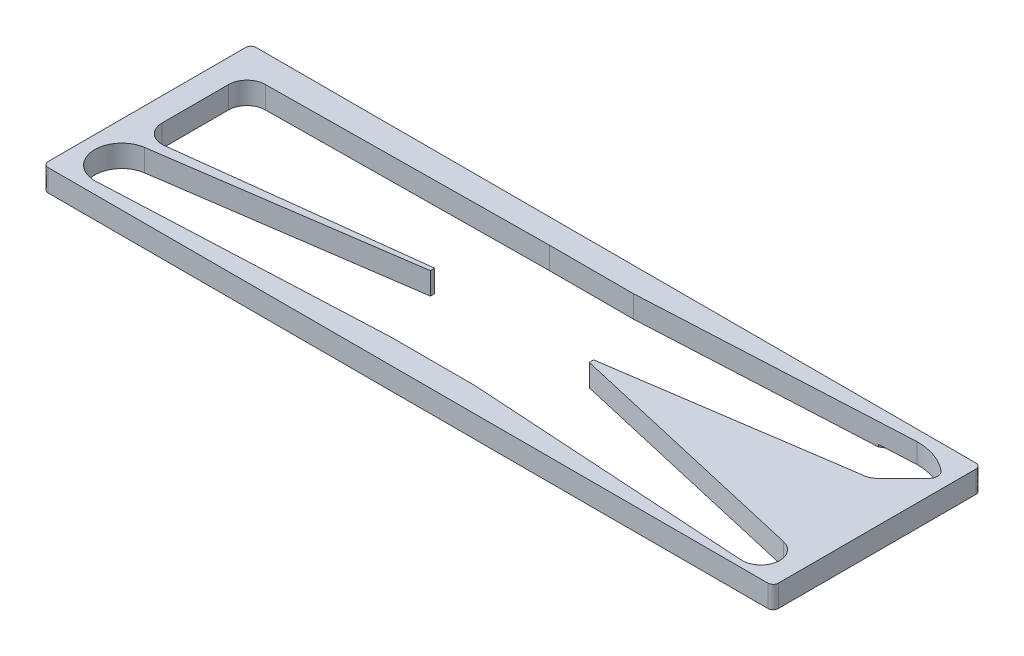
from build123d import *

# Parameters (mm, degrees)
BOSS_EXTRUDE3_DEPTH = 50.8
SKETCH3_R           = 44.45
CUT_EXTRUDE1_DEPTH  = 5.08


with BuildPart() as part:
    # Sketch2 → Boss-Extrude3 (new body)
    with BuildSketch(Plane(origin=(0, 0, 0), x_dir=(1, 0, 0), z_dir=(0, 1, 0))):
        with BuildLine():
            Line((828.937277778, 239.610630395), (-828.937277778, 239.610630395))
            add(Edge.make_bspline(
                [(-828.937277778, 239.610630395), (-830.5402629, 239.610630395), (-833.790113095, 238.979161906), (-837.861109298, 236.262109298), (-840.578161906, 232.191113095), (-841.209630395, 228.9412629), (-841.209630395, 227.338277778)],
                knots=[-0.770319033, -0.770319033, -0.770319033, -0.770319033, -0.385159516, 0, 0.385159516, 0.770319033, 0.770319033, 0.770319033, 0.770319033], degree=3))
            Line((-841.209630395, 227.338277778), (-841.209630395, -227.338277778))
            add(Edge.make_bspline(
                [(-841.209630395, -227.338277778), (-841.209630395, -228.9412629), (-840.578161906, -232.191113095), (-837.861109298, -236.262109298), (-833.790113095, -238.979161906), (-830.5402629, -239.610630395), (-828.937277778, -239.610630395)],
                knots=[-0.770319033, -0.770319033, -0.770319033, -0.770319033, -0.385159516, 0, 0.385159516, 0.770319033, 0.770319033, 0.770319033, 0.770319033], degree=3))
            Line((-828.937277778, -239.610630395), (828.937277778, -239.610630395))
            add(Edge.make_bspline(
                [(828.937277778, -239.610630395), (830.5402629, -239.610630395), (833.790113095, -238.979161906), (837.861109298, -236.262109298), (840.578161906, -232.191113095), (841.209630395, -228.9412629), (841.209630395, -227.338277778)],
                knots=[-0.770319033, -0.770319033, -0.770319033, -0.770319033, -0.385159516, 0, 0.385159516, 0.770319033, 0.770319033, 0.770319033, 0.770319033], degree=3))
            Line((841.209630395, -227.338277778), (841.209630395, 227.338277778))
            add(Edge.make_bspline(
                [(841.209630395, 227.338277778), (841.209630395, 228.9412629), (840.578161906, 232.191113095), (837.861109298, 236.262109298), (833.790113095, 238.979161906), (830.5402629, 239.610630395), (828.937277778, 239.610630395)],
                knots=[-0.770319033, -0.770319033, -0.770319033, -0.770319033, -0.385159516, 0, 0.385159516, 0.770319033, 0.770319033, 0.770319033, 0.770319033], degree=3))
        make_face()
        with BuildLine():
            Line((183, 5), (719.067867535, 84.701940777))
            ThreePointArc((719.067867535, 84.701940777), (734.37520483, 87.746759477), (747.352138783, 96.41766953))
            Line((747.352138783, 96.41766953), (805.740119782, 154.805650529))
            ThreePointArc((805.740119782, 154.805650529), (811.568721914, 170.02928211), (804.130185735, 184.534444667))
            ThreePointArc((804.130185735, 184.534444667), (764.162148174, 206.781275976), (719.074, 214.489999861))
            Line((719.074, 214.489999861), (97, 183))
            Line((97, 183), (-97, 183))
            Line((-97, 183), (-744.729609, 176.382687101))
            ThreePointArc((-744.729609, 176.382687101), (-774.626285266, 163.729853371), (-786.973045304, 133.705480442))
            Line((-786.973045304, 133.705480442), (-786.865578677, -19.509544471))
            ThreePointArc((-786.865578677, -19.509544471), (-772.505899638, -51.439554767), (-739.089614065, -61.883586467))
            Line((-739.089614065, -61.883586467), (-183, 5))
            Line((-183, 5), (-183, -5))
            Line((-183, -5), (-757.976293163, -88.338177387))
            ThreePointArc((-757.976293163, -88.338177387), (-811.160134278, -154.450903881), (-749.042879972, -212.251079294))
            Line((-749.042879972, -212.251079294), (-97, -183))
            Line((-97, -183), (97, -183))
            Line((97, -183), (751.749025656, -224.140342752))
            ThreePointArc((751.749025656, -224.140342752), (797.345746833, -187.130639885), (764.1784404, -138.667160105))
            Line((764.1784404, -138.667160105), (183, -5))
            Line((183, -5), (183, 5))
        make_face(mode=Mode.SUBTRACT)
    extrude(amount=BOSS_EXTRUDE3_DEPTH)

    # Sketch3 → Cut-Extrude1 (cut)
    with BuildSketch(Plane.XZ):
        with Locations((754.506388348, 181.844577047)):
            Circle(SKETCH3_R)
        with BuildLine():
            Line((820.56615944, -139.979610872), (762.17817844, -81.591629872))
            ThreePointArc((762.17817844, -81.591629872), (719.067867535, -63.734754417), (675.95755663, -81.591629872))
            Line((675.95755663, -81.591629872), (617.569575631, -139.979610872))
            ThreePointArc((617.569575631, -139.979610872), (605.630504143, -171.163078474), (620.867299038, -200.874863358))
            ThreePointArc((620.867299038, -200.874863358), (719.067867535, -235.45718636), (817.268436033, -200.874863358))
            ThreePointArc((817.268436033, -200.874863358), (832.505230927, -171.163078474), (820.56615944, -139.979610872))
        make_face()
    extrude(amount=-CUT_EXTRUDE1_DEPTH, mode=Mode.SUBTRACT)


solid = part.part
